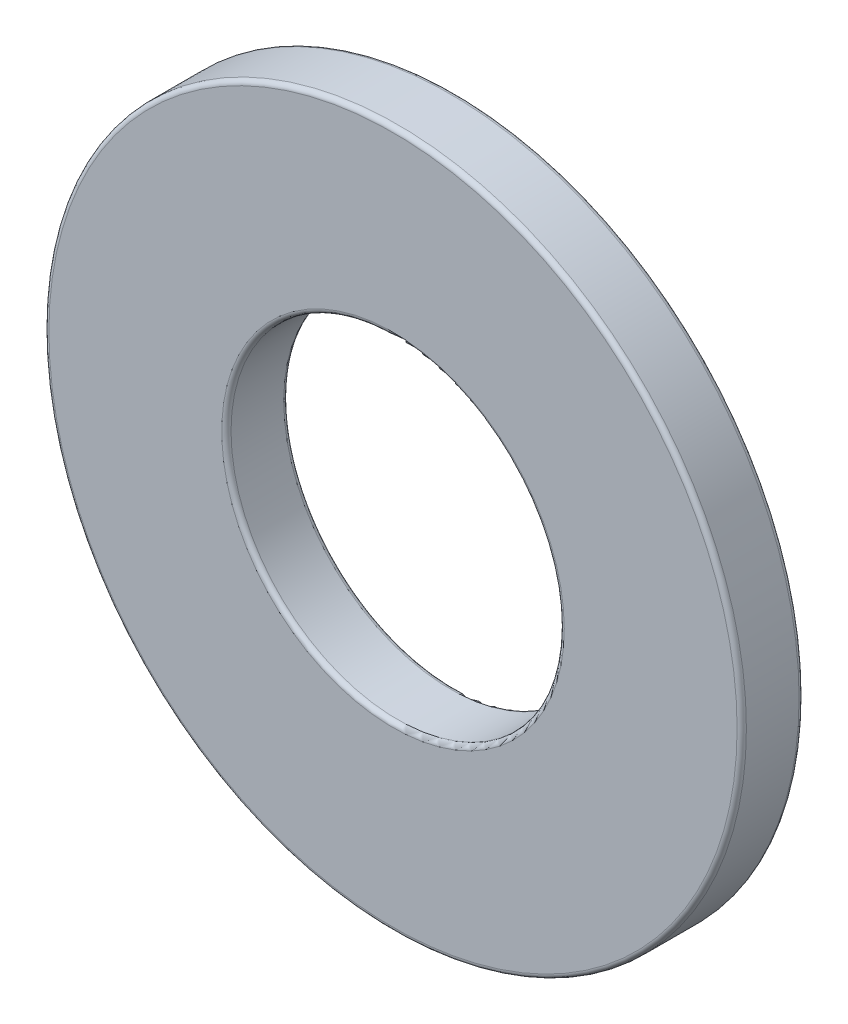
from build123d import *

# Parameters (mm, degrees)
BOSS_EXTRUDE1_START = 0.4
SKETCH3_R           = 4.5
SKETCH3_R_2         = 2.15
BOSS_EXTRUDE1_DEPTH = 0.8
FILLET1_R           = 0.06


with BuildPart() as part:
    # Sketch3 → Boss-Extrude1 (new body)
    with BuildSketch(Plane.XY.offset(BOSS_EXTRUDE1_START)):
        Circle(SKETCH3_R)
        Circle(SKETCH3_R_2, mode=Mode.SUBTRACT)
    extrude(amount=-BOSS_EXTRUDE1_DEPTH)

    # Fillet1
    fillet1_edges = [part.edges().sort_by_distance(p)[0] for p in [
        (-4.5, 0, 0.4),
        (-4.5, 0, -0.4),
        (-2.15, 0, -0.4),
        (-2.15, 0, 0.4),
    ]]
    fillet(fillet1_edges, radius=FILLET1_R)


solid = part.part
